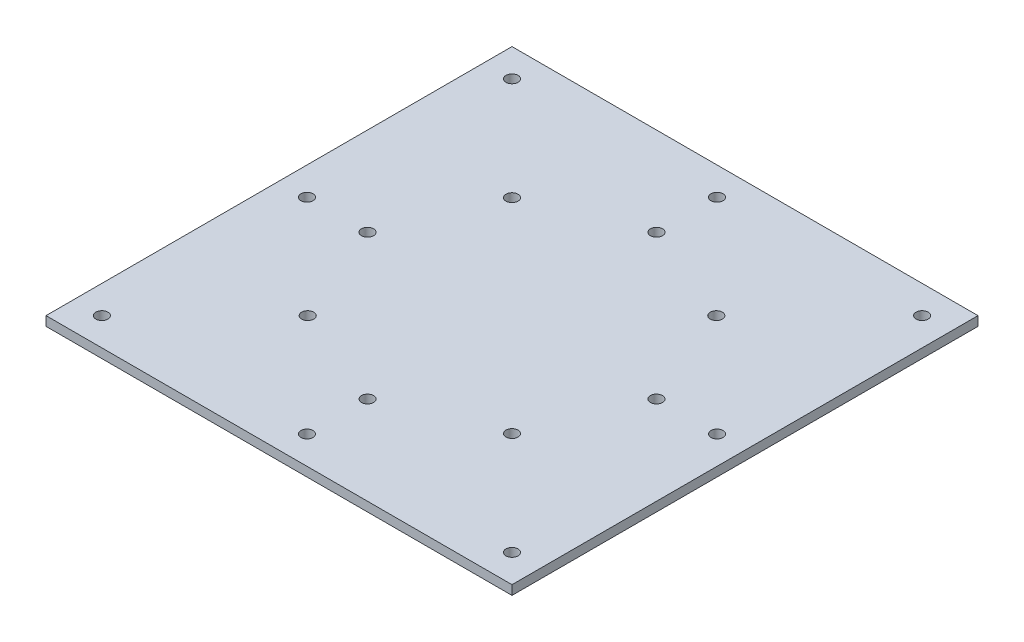
from build123d import *

# Parameters (mm, degrees)
SKETCH1_W           = 250
SKETCH1_H           = 250
SKETCH1_R           = 3.25
BOSS_EXTRUDE1_DEPTH = 5


with BuildPart() as part:
    # Sketch1 → Boss-Extrude1 (new body)
    with BuildSketch(Plane(origin=(0, 0, 0), x_dir=(1, 0, 0), z_dir=(0, 1, 0))):
        Rectangle(SKETCH1_W, SKETCH1_H)
        with Locations(Location((-110, 110, 0), (0, 0, 270))):
            Circle(SKETCH1_R, mode=Mode.SUBTRACT)
        with Locations(Location((0, 110, 0), (0, 0, 270))):
            Circle(SKETCH1_R, mode=Mode.SUBTRACT)
        with Locations(Location((-54.800775542, 54.800775542, 0), (0, 0, 270))):
            Circle(SKETCH1_R, mode=Mode.SUBTRACT)
        with Locations(Location((0, 77.5, 0), (0, 0, 270))):
            Circle(SKETCH1_R, mode=Mode.SUBTRACT)
        with Locations(Location((54.800775542, 54.800775542, 0), (0, 0, 270))):
            Circle(SKETCH1_R, mode=Mode.SUBTRACT)
        with Locations(Location((77.5, 0, 0), (0, 0, 270))):
            Circle(SKETCH1_R, mode=Mode.SUBTRACT)
        with Locations(Location((54.800775542, -54.800775542, 0), (0, 0, 270))):
            Circle(SKETCH1_R, mode=Mode.SUBTRACT)
        with Locations(Location((0, -77.5, 0), (0, 0, 270))):
            Circle(SKETCH1_R, mode=Mode.SUBTRACT)
        with Locations(Location((-54.800775542, -54.800775542, 0), (0, 0, 270))):
            Circle(SKETCH1_R, mode=Mode.SUBTRACT)
        with Locations(Location((-77.5, 0, 0), (0, 0, 270))):
            Circle(SKETCH1_R, mode=Mode.SUBTRACT)
        with Locations(Location((110, 110, 0), (0, 0, 270))):
            Circle(SKETCH1_R, mode=Mode.SUBTRACT)
        with Locations(Location((110, 0, 0), (0, 0, 270))):
            Circle(SKETCH1_R, mode=Mode.SUBTRACT)
        with Locations(Location((0, -110, 0), (0, 0, 270))):
            Circle(SKETCH1_R, mode=Mode.SUBTRACT)
        with Locations(Location((110, -110, 0), (0, 0, 270))):
            Circle(SKETCH1_R, mode=Mode.SUBTRACT)
        with Locations(Location((-110, 0, 0), (0, 0, 270))):
            Circle(SKETCH1_R, mode=Mode.SUBTRACT)
        with Locations(Location((-110, -110, 0), (0, 0, 270))):
            Circle(SKETCH1_R, mode=Mode.SUBTRACT)
    extrude(amount=BOSS_EXTRUDE1_DEPTH)


solid = part.part
